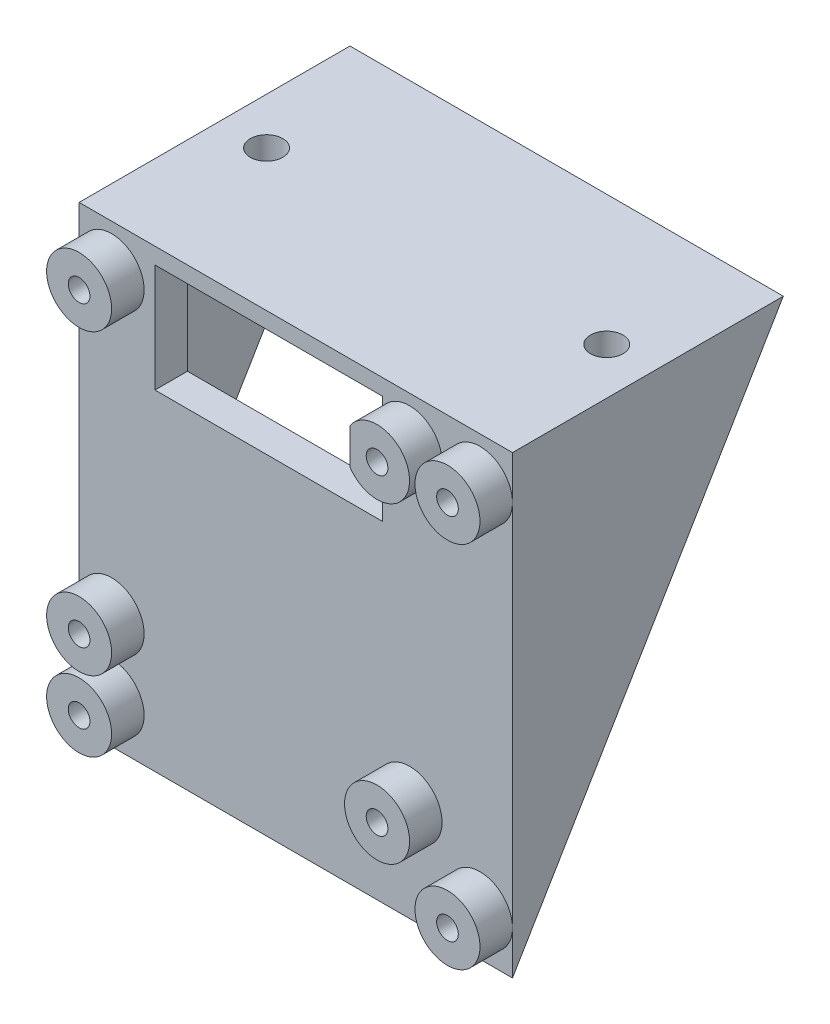
from build123d import *

# Parameters (mm, degrees)
EXTRUDE_1_DEPTH      = 40
SKETCH_2_W           = 20.831357784
SKETCH_2_H           = 30.068143155
CUT_EXTRUDE_1_DEPTH  = 36
SKETCH_3_R           = 1.5
CUT_EXTRUDE_2_DEPTH  = 32
EXTRUDE_2_DEPTH      = 3
EXTRUDE_2_DEPTH_BACK = 1
SKETCH_4_R           = 3
SKETCH_4_R_2         = 1
SKETCH_5_R           = 1
SKETCH_5_R_2         = 0.928338532
CUT_EXTRUDE_3_DEPTH  = 65.404968752


with BuildPart() as part:
    # 草图1 → 凸台-拉伸1 (new body)
    with BuildSketch(Plane(origin=(0, 0, 0), x_dir=(0, 0, -1), z_dir=(1, 0, 0))):
        Polygon((0, 0), (0, -42), (25, 0), align=None)
    extrude(amount=EXTRUDE_1_DEPTH)

    # 草图2 → 切除-拉伸1 (cut)
    with BuildSketch(Plane(origin=(38, 0, 0), x_dir=(0, 0, -1), z_dir=(1, 0, 0))):
        with Locations((13.415678892, -18.034071578)):
            Rectangle(SKETCH_2_W, SKETCH_2_H)
    extrude(amount=-CUT_EXTRUDE_1_DEPTH, mode=Mode.SUBTRACT)

    # 草图3 → 切除-拉伸2 (cut)
    with BuildSketch(Plane(origin=(0, 0, 0), x_dir=(1, 0, 0), z_dir=(0, 1, 0))):
        with Locations(Location((4.3, 13, 0), (0, 0, 270))):
            Circle(SKETCH_3_R)
        with Locations(Location((35.7, 13, 0), (0, 0, 270))):
            Circle(SKETCH_3_R)
    extrude(amount=-CUT_EXTRUDE_2_DEPTH, mode=Mode.SUBTRACT)

    # 草图4 → 凸台-拉伸2 (add, two sides: drawn at the far end of the back side and taken through both)
    # profile 1 of 7: a face of its own
    with BuildSketch(Plane.XY.offset(-EXTRUDE_2_DEPTH_BACK)):
        with Locations((3, -4)):
            Circle(SKETCH_4_R)
        with Locations((3, -4)):
            Circle(SKETCH_4_R_2, mode=Mode.SUBTRACT)
    # profile 2 of 7: a face of its own
    with BuildSketch(Plane.XY.offset(-EXTRUDE_2_DEPTH_BACK)):
        with Locations((37, -4)):
            Circle(SKETCH_4_R)
        with Locations((37, -4)):
            Circle(SKETCH_4_R_2, mode=Mode.SUBTRACT)
    # profile 3 of 7: a face of its own
    with BuildSketch(Plane.XY.offset(-EXTRUDE_2_DEPTH_BACK)):
        with Locations((37, -38)):
            Circle(SKETCH_4_R)
        with Locations((37, -38)):
            Circle(SKETCH_4_R_2, mode=Mode.SUBTRACT)
    # profile 4 of 7: a face of its own
    with BuildSketch(Plane.XY.offset(-EXTRUDE_2_DEPTH_BACK)):
        with Locations((3, -38)):
            Circle(SKETCH_4_R)
        with Locations((3, -38)):
            Circle(SKETCH_4_R_2, mode=Mode.SUBTRACT)
    # profile 5 of 7: a face of its own
    with BuildSketch(Plane.XY.offset(-EXTRUDE_2_DEPTH_BACK)):
        with Locations((30.5, -4)):
            Circle(SKETCH_4_R)
        with Locations((30.5, -4)):
            Circle(SKETCH_4_R_2, mode=Mode.SUBTRACT)
    # profile 6 of 7: a face of its own
    with BuildSketch(Plane.XY.offset(-EXTRUDE_2_DEPTH_BACK)):
        with Locations((30.5, -32.820866307)):
            Circle(SKETCH_4_R)
        with Locations((30.5, -32.820866307)):
            Circle(SKETCH_4_R_2, mode=Mode.SUBTRACT)
    # profile 7 of 7: a face of its own
    with BuildSketch(Plane.XY.offset(-EXTRUDE_2_DEPTH_BACK)):
        with Locations((3, -31.5)):
            Circle(SKETCH_4_R)
        with Locations((3, -31.5)):
            Circle(SKETCH_4_R_2, mode=Mode.SUBTRACT)
    extrude(amount=EXTRUDE_2_DEPTH + EXTRUDE_2_DEPTH_BACK)

    # 草图5 → 切除-拉伸3 (cut, through all)
    with BuildSketch(Plane.XY.offset(3)):
        with Locations((3, -4)):
            Circle(SKETCH_5_R)
        with Locations((37, -4)):
            Circle(SKETCH_5_R)
        with Locations(Location((37, -38, 0), (0, 0, 90))):
            Circle(SKETCH_5_R_2)
        with Locations((3, -38)):
            Circle(SKETCH_5_R)
        Polygon((20, -1.5), (7, -1.5), (7, -11.5), (20, -11.5), (28, -11.5), (28, -1.5), align=None)
    extrude(amount=-CUT_EXTRUDE_3_DEPTH, mode=Mode.SUBTRACT)


solid = part.part
